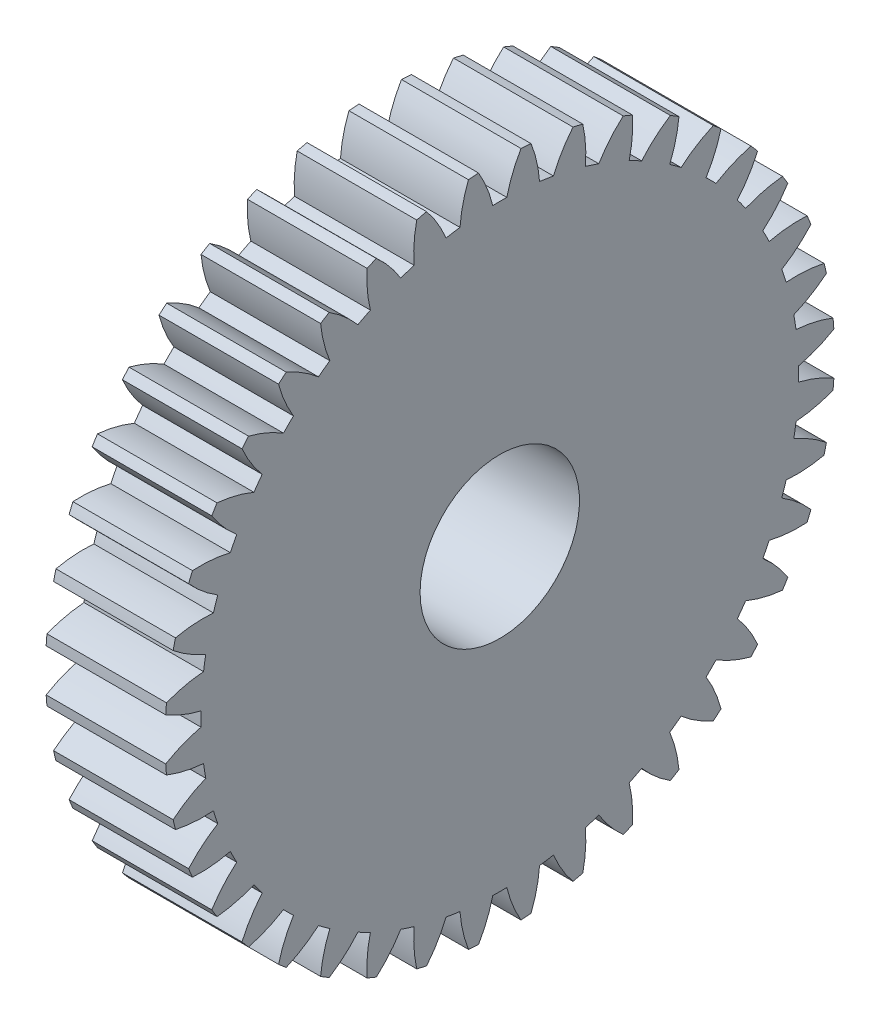
from build123d import *

# Parameters (mm, degrees)
BASPROSKE_W     = 15
BASPROSKE_H     = 42
TOOTHCUT_DEPTH  = 62.26173357
TEETHCUTS_COUNT = 40
TEETHCUTS_ANGLE = 351
BORSKE_R        = 10
BORE_DEPTH      = 50.0001016


with BuildPart() as part:
    # BasProSke → Base-Revolve (revolve)
    with BuildSketch(Plane(origin=(0, 0, 0), x_dir=(1, 0, 0), z_dir=(0, 1, 0)), mode=Mode.PRIVATE) as base_revolve_sk:
        with Locations((7.5, 21)):
            Rectangle(BASPROSKE_W, BASPROSKE_H)
    revolve(base_revolve_sk.sketch.rotate(Axis((-10, 0, 0), (1, 0, 0)), 180), axis=Axis((-10, 0, 0), (1, 0, 0)))

    # TooCutSke → ToothCut (cut, through all)
    with BuildSketch(Plane(origin=(0, 0, 0), x_dir=(0, 0, -1), z_dir=(1, 0, 0))):
        with BuildLine():
            ThreePointArc((0.882812088, 37.488606854), (0, 37.499), (-0.882812088, 37.488606854))
            ThreePointArc((-0.882812088, 37.488606854), (-1.612748684, 39.782000434), (-2.678427154, 41.939960338))
            ThreePointArc((-2.678427154, 41.939960338), (0, 42.0254), (2.678427154, 41.939960338))
            ThreePointArc((2.678427154, 41.939960338), (1.612748684, 39.782000434), (0.882812088, 37.488606854))
        make_face()
    toothcut = extrude(amount=TOOTHCUT_DEPTH, mode=Mode.SUBTRACT)

    # TeethCuts: ToothCut ×40 about axis
    teethcuts_axis = Axis((-10, 0, 0), (1, 0, 0))
    for i in range(1, TEETHCUTS_COUNT):
        add(toothcut.rotate(teethcuts_axis, i * TEETHCUTS_ANGLE / (TEETHCUTS_COUNT - 1)), mode=Mode.SUBTRACT)

    # BorSke → Bore (cut, symmetric)
    with BuildSketch(Plane(origin=(0, 0, 0), x_dir=(0, 0, -1), z_dir=(1, 0, 0))):
        with Locations(Location((0, 0, 0), (0, 0, 180))):
            Circle(BORSKE_R)
    extrude(amount=BORE_DEPTH, both=True, mode=Mode.SUBTRACT)


solid = part.part
